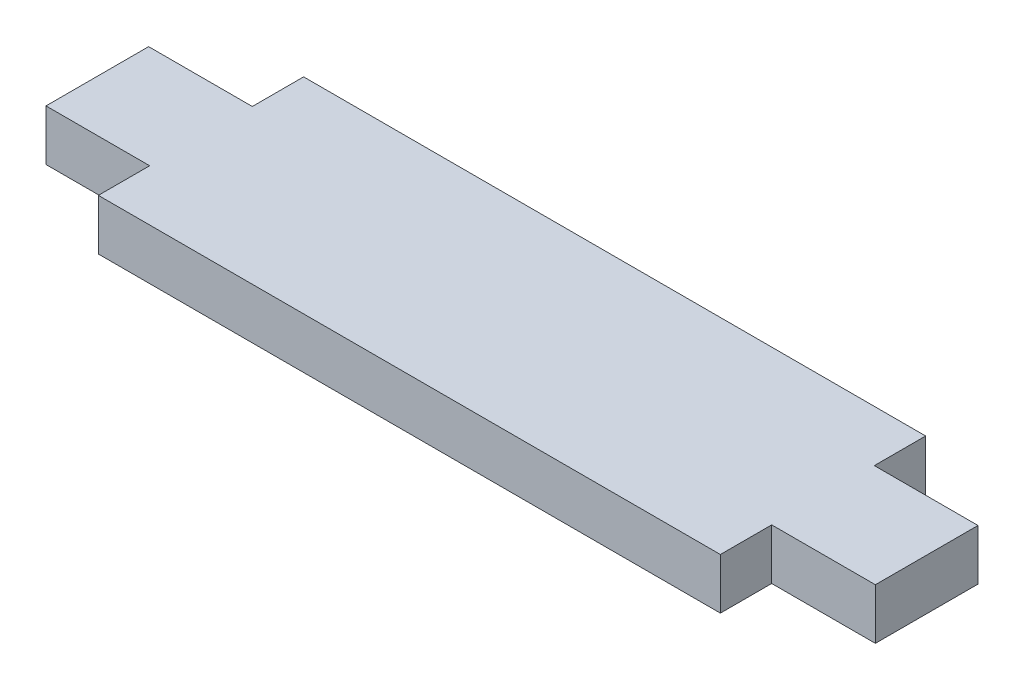
from build123d import *

# Parameters (mm, degrees)
SKETCH1_W           = 19.8
SKETCH1_H           = 4.9
BOSS_EXTRUDE1_DEPTH = 30
SKETCH2_W           = 9.9
SKETCH2_H           = 4.9
BOSS_EXTRUDE2_DEPTH = 10


with BuildPart() as part:
    # Sketch1 → Boss-Extrude1 (new, symmetric)
    with BuildSketch(Plane(origin=(0, 0, 0), x_dir=(0, 0, -1), z_dir=(1, 0, 0))):
        Rectangle(SKETCH1_W, SKETCH1_H)
    extrude(amount=BOSS_EXTRUDE1_DEPTH, both=True)

    # Sketch2 → Boss-Extrude2 (add)
    with BuildSketch(Plane(origin=(30, 0, 0), x_dir=(0, 0, -1), z_dir=(1, 0, 0))):
        Rectangle(SKETCH2_W, SKETCH2_H)
    boss_extrude2 = extrude(amount=BOSS_EXTRUDE2_DEPTH)

    # Mirror1: Boss-Extrude2 across plane
    add(boss_extrude2.mirror(Plane(origin=(0, 0, 0), x_dir=(0, 0, 1), z_dir=(1, 0, 0))))


solid = part.part
